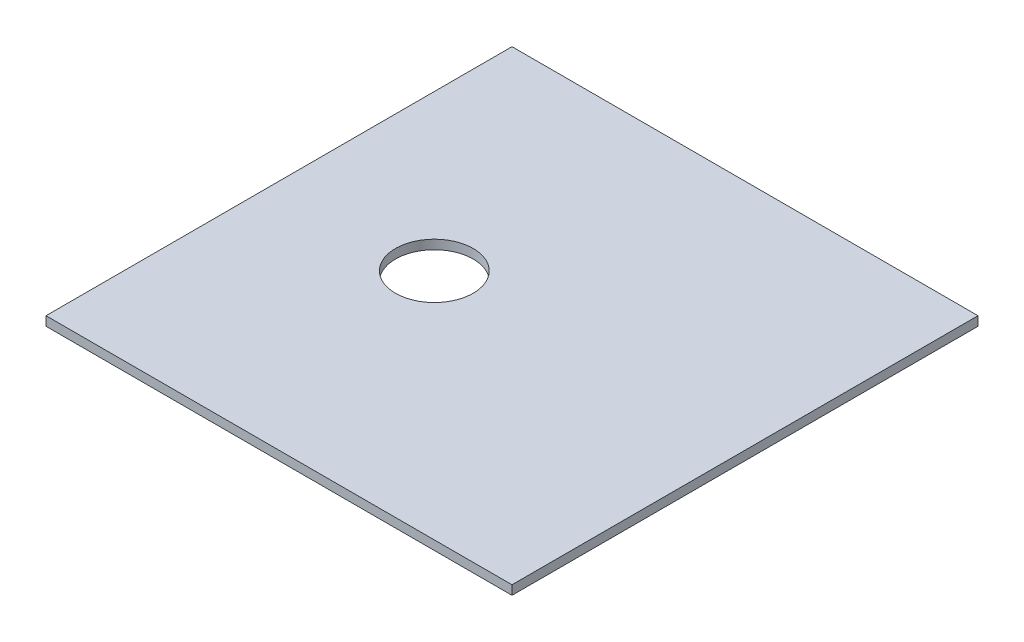
from build123d import *

# Parameters (mm, degrees)
SKETCH1_W           = 152.4
SKETCH1_H           = 152.4
SKETCH1_R           = 5
SKETCH1_R_2         = 12.7
BOSS_EXTRUDE1_DEPTH = 3


with BuildPart() as part:
    # Sketch1 → Boss-Extrude1 (new body)
    # profile 1 of 5: a face of its own
    with BuildSketch(Plane(origin=(0, 0, 0), x_dir=(1, 0, 0), z_dir=(0, 1, 0))):
        Rectangle(SKETCH1_W, SKETCH1_H)
        with Locations((57.513684792, -57.513684792)):
            Circle(SKETCH1_R, mode=Mode.SUBTRACT)
        with Locations((57.513684792, 57.513684792)):
            Circle(SKETCH1_R, mode=Mode.SUBTRACT)
        with Locations((-57.513684792, 57.513684792)):
            Circle(SKETCH1_R, mode=Mode.SUBTRACT)
        with Locations((-57.513684792, -57.513684792)):
            Circle(SKETCH1_R, mode=Mode.SUBTRACT)
        with Locations(Location((-25.4, 0, 0), (0, 0, 270))):
            Circle(SKETCH1_R_2, mode=Mode.SUBTRACT)
    # profile 2 of 5: a face of its own
    with BuildSketch(Plane(origin=(0, 0, 0), x_dir=(1, 0, 0), z_dir=(0, 1, 0))):
        with Locations((57.513684792, -57.513684792)):
            Circle(SKETCH1_R)
    # profile 3 of 5: a face of its own
    with BuildSketch(Plane(origin=(0, 0, 0), x_dir=(1, 0, 0), z_dir=(0, 1, 0))):
        with Locations((-57.513684792, -57.513684792)):
            Circle(SKETCH1_R)
    # profile 4 of 5: a face of its own
    with BuildSketch(Plane(origin=(0, 0, 0), x_dir=(1, 0, 0), z_dir=(0, 1, 0))):
        with Locations((57.513684792, 57.513684792)):
            Circle(SKETCH1_R)
    # profile 5 of 5: a face of its own
    with BuildSketch(Plane(origin=(0, 0, 0), x_dir=(1, 0, 0), z_dir=(0, 1, 0))):
        with Locations((-57.513684792, 57.513684792)):
            Circle(SKETCH1_R)
    extrude(amount=-BOSS_EXTRUDE1_DEPTH)


solid = part.part
